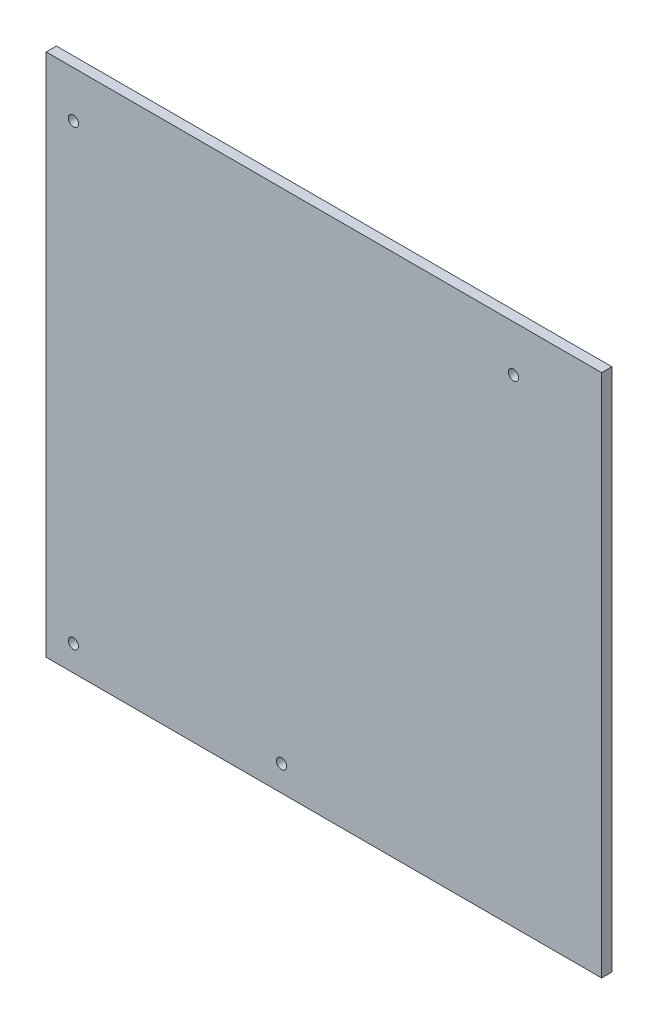
from build123d import *

# Parameters (mm, degrees)
SKETCH1_W           = 162.83
SKETCH1_H           = 153.6666
SKETCH1_R           = 1.5
BOSS_EXTRUDE1_DEPTH = 3


with BuildPart() as part:
    # Sketch1 → Boss-Extrude1 (new body)
    with BuildSketch(Plane.XY):
        with Locations((81.415, 76.8333)):
            Rectangle(SKETCH1_W, SKETCH1_H)
        with Locations((8, 140.1666)):
            Circle(SKETCH1_R, mode=Mode.SUBTRACT)
        with Locations((137, 140.1666)):
            Circle(SKETCH1_R, mode=Mode.SUBTRACT)
        with Locations((8, 7.5)):
            Circle(SKETCH1_R, mode=Mode.SUBTRACT)
        with Locations((69, 7.5)):
            Circle(SKETCH1_R, mode=Mode.SUBTRACT)
    extrude(amount=BOSS_EXTRUDE1_DEPTH)


solid = part.part
